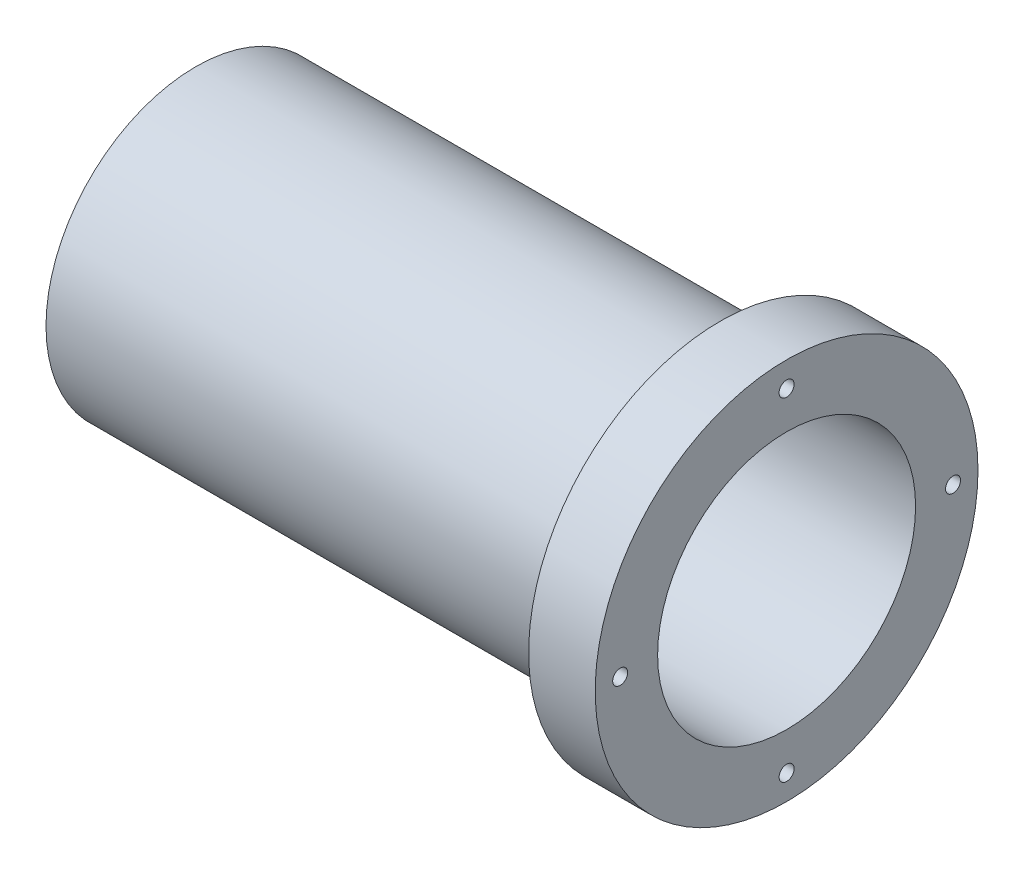
from build123d import *

# Parameters (mm, degrees)
SKETCH_1_R          = 36
SKETCH_1_R_2        = 31
EXTRUDE_1_DEPTH     = 121
SKETCH_2_R          = 46
SKETCH_2_R_2        = 31
EXTRUDE_2_DEPTH     = 16
EXTRUDE_START       = 2
SKETCH_3_R          = 36
SKETCH_3_R_2        = 28.5
EXTRUDE_3_DEPTH     = 2
EXTRUDE_START_2     = 3
SKETCH_4_R          = 36
SKETCH_4_R_2        = 17
EXTRUDE_4_DEPTH     = 3
SKETCH_5_R          = 1.8
CUT_EXTRUDE_1_DEPTH = 20


with BuildPart() as part:
    # 草图1 → 凸台-拉伸1 (new body)
    with BuildSketch(Plane(origin=(0, 0, 0), x_dir=(0, 0, -1), z_dir=(1, 0, 0))):
        Circle(SKETCH_1_R)
        Circle(SKETCH_1_R_2, mode=Mode.SUBTRACT)
    extrude(amount=EXTRUDE_1_DEPTH)

    # 草图2 → 凸台-拉伸2 (add)
    with BuildSketch(Plane(origin=(121, 0, 0), x_dir=(0, 0, -1), z_dir=(1, 0, 0))):
        Circle(SKETCH_2_R)
        Circle(SKETCH_2_R_2, mode=Mode.SUBTRACT)
    extrude(amount=EXTRUDE_2_DEPTH)

    # 草图3 → 凸台-拉伸3 (add)
    with BuildSketch(Plane.ZY.offset(EXTRUDE_START)):
        Circle(SKETCH_3_R)
        Circle(SKETCH_3_R_2, mode=Mode.SUBTRACT)
    extrude(amount=-EXTRUDE_3_DEPTH)

    # 草图4 → 凸台-拉伸4 (add)
    with BuildSketch(Plane.ZY.offset(2).offset(EXTRUDE_START_2)):
        Circle(SKETCH_4_R)
        Circle(SKETCH_4_R_2, mode=Mode.SUBTRACT)
    extrude(amount=-EXTRUDE_4_DEPTH)

    # 草图5 → 切除-拉伸1 (cut)
    with BuildSketch(Plane(origin=(137, 0, 0), x_dir=(0, 0, -1), z_dir=(1, 0, 0))):
        with Locations((0, 40)):
            Circle(SKETCH_5_R)
        with Locations((40, 0)):
            Circle(SKETCH_5_R)
        with Locations((0, -40)):
            Circle(SKETCH_5_R)
        with Locations((-40, 0)):
            Circle(SKETCH_5_R)
    extrude(amount=-CUT_EXTRUDE_1_DEPTH, mode=Mode.SUBTRACT)


solid = part.part
